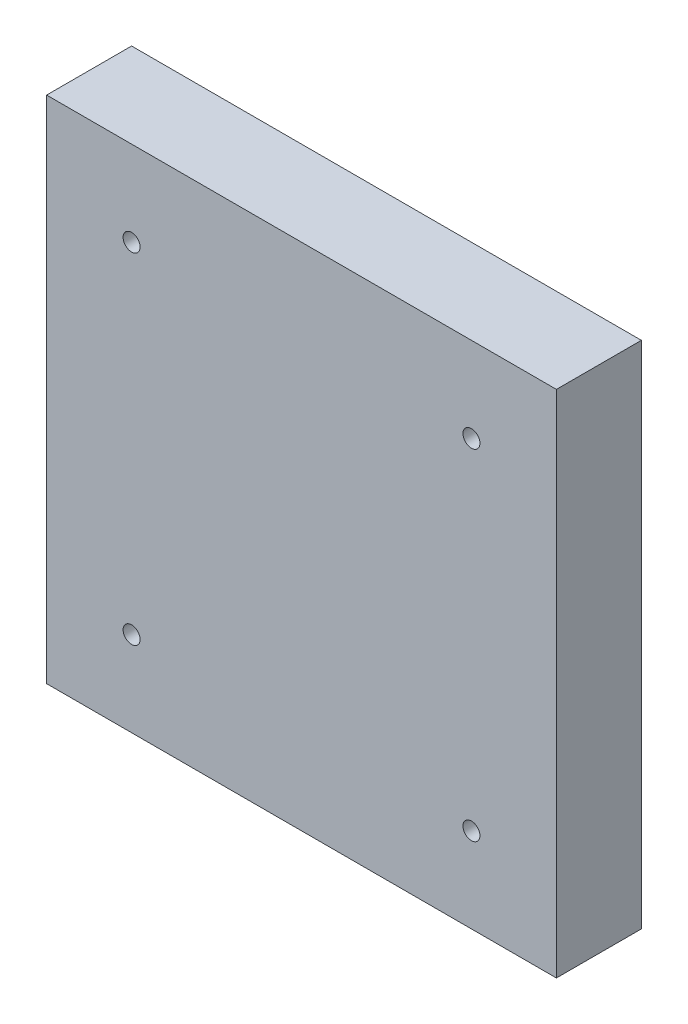
from build123d import *

# Parameters (mm, degrees)
SKETCH1_W           = 76.2
SKETCH1_H           = 76.2
SKETCH1_R           = 1.27
BOSS_EXTRUDE1_DEPTH = 12.7


with BuildPart() as part:
    # Sketch1 → Boss-Extrude1 (new body)
    with BuildSketch(Plane.XY):
        with Locations((38.1, 38.1)):
            Rectangle(SKETCH1_W, SKETCH1_H)
        with Locations((12.7, 12.7)):
            Circle(SKETCH1_R, mode=Mode.SUBTRACT)
        with Locations((12.7, 63.5)):
            Circle(SKETCH1_R, mode=Mode.SUBTRACT)
        with Locations((63.5, 63.5)):
            Circle(SKETCH1_R, mode=Mode.SUBTRACT)
        with Locations((63.5, 12.7)):
            Circle(SKETCH1_R, mode=Mode.SUBTRACT)
    extrude(amount=BOSS_EXTRUDE1_DEPTH)


solid = part.part
